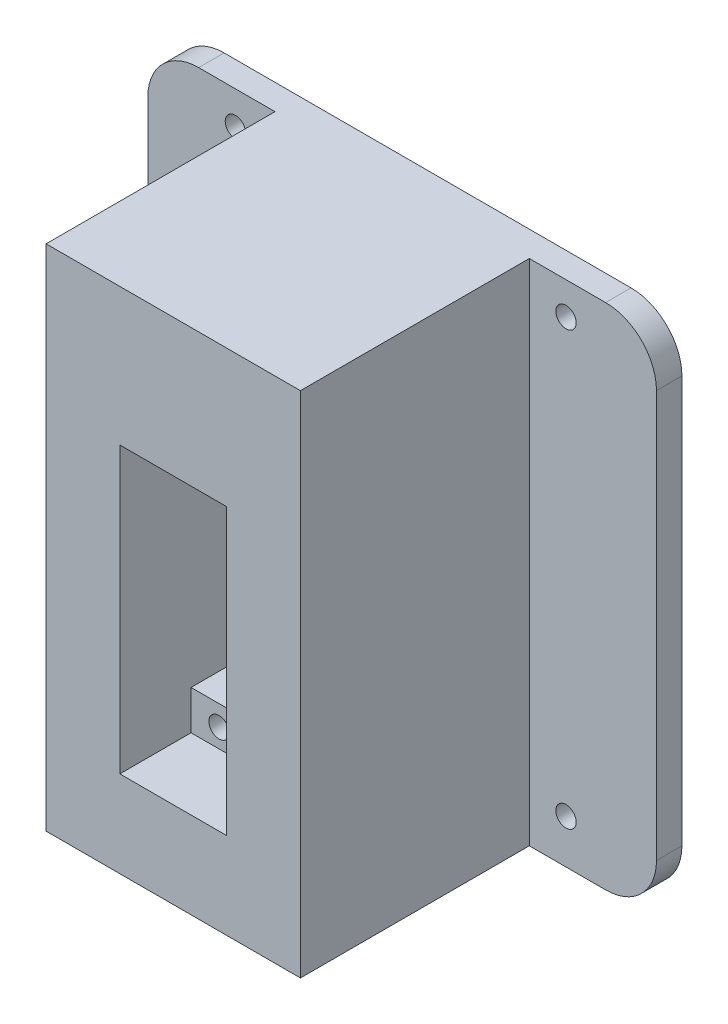
from build123d import *

# Parameters (mm, degrees)
BOSS_EXTRUDE1_DEPTH = 50
SKETCH2_W           = 21
SKETCH2_H           = 56
CUT_EXTRUDE1_DEPTH  = 14
CUT_EXTRUDE2_DEPTH  = 40
CUT_EXTRUDE3_START  = -45
CUT_EXTRUDE3_DEPTH  = 45
SKETCH5_R           = 2
CUT_EXTRUDE4_DEPTH  = 10
SKETCH6_R           = 2
CUT_EXTRUDE5_DEPTH  = 5


with BuildPart() as part:
    # Sketch1 → Boss-Extrude1 (new body)
    with BuildSketch(Plane.XY):
        with BuildLine():
            Line((-40, 50), (40, 50))
            ThreePointArc((40, 50), (47.071067812, 47.071067812), (50, 40))
            Line((50, 40), (50, -40))
            ThreePointArc((50, -40), (47.071067812, -47.071067812), (40, -50))
            Line((40, -50), (-40, -50))
            ThreePointArc((-40, -50), (-47.071067812, -47.071067812), (-50, -40))
            Line((-50, -40), (-50, 40))
            ThreePointArc((-50, 40), (-47.071067812, 47.071067812), (-40, 50))
        make_face()
    extrude(amount=BOSS_EXTRUDE1_DEPTH)

    # Sketch2 → Cut-Extrude1 (cut)
    with BuildSketch(Plane.XY.offset(50)):
        with Locations((0, -5)):
            Rectangle(SKETCH2_W, SKETCH2_H)
    extrude(amount=-CUT_EXTRUDE1_DEPTH, mode=Mode.SUBTRACT)

    # Sketch3 → Cut-Extrude2 (cut)
    with BuildSketch(Plane.XY.offset(36)):
        Polygon((-10.5, 16.220000255), (-10.5, -25.279999745), (10.5, -25.279999745), (10.5, 16.220000255), (2.75, 16.220000255), (2.728552587, 23.719969589), (-2.771447413, 23.719969589), (-2.75, 16.220000255), align=None)
    extrude(amount=-CUT_EXTRUDE2_DEPTH, mode=Mode.SUBTRACT)

    # Sketch4 → Cut-Extrude3 (cut)
    with BuildSketch(Plane.XY.offset(50).offset(CUT_EXTRUDE3_START)):
        with BuildLine():
            Line((40, -50), (25, -50))
            Line((25, -50), (25, 50))
            Line((25, 50), (40, 50))
            ThreePointArc((40, 50), (47.071067812, 47.071067812), (50, 40))
            Line((50, 40), (50, -40))
            ThreePointArc((50, -40), (47.071067812, -47.071067812), (40, -50))
        make_face()
        with BuildLine():
            Line((-40, -50), (-25, -50))
            Line((-25, -50), (-25, 50))
            Line((-25, 50), (-40, 50))
            ThreePointArc((-40, 50), (-47.071067812, 47.071067812), (-50, 40))
            Line((-50, 40), (-50, -40))
            ThreePointArc((-50, -40), (-47.071067812, -47.071067812), (-40, -50))
        make_face()
    extrude(amount=CUT_EXTRUDE3_DEPTH, mode=Mode.SUBTRACT)

    # Sketch5 → Cut-Extrude4 (cut)
    with BuildSketch(Plane.XY.offset(36)):
        with Locations((-5, 19.5)):
            Circle(SKETCH5_R)
        with Locations((5, 19.5)):
            Circle(SKETCH5_R)
        with Locations((-5, -29.3)):
            Circle(SKETCH5_R)
        with Locations((5, -29.3)):
            Circle(SKETCH5_R)
    extrude(amount=-CUT_EXTRUDE4_DEPTH, mode=Mode.SUBTRACT)

    # Sketch6 → Cut-Extrude5 (cut)
    with BuildSketch(Plane.XY.offset(5)):
        with Locations((-32.783708715, 43.482376607)):
            Circle(SKETCH6_R)
        with Locations((-32.783708715, -41.517623393)):
            Circle(SKETCH6_R)
        with Locations((32.216291285, -41.364915091)):
            Circle(SKETCH6_R)
        with Locations((32.216291285, 43.635084909)):
            Circle(SKETCH6_R)
    extrude(amount=-CUT_EXTRUDE5_DEPTH, mode=Mode.SUBTRACT)


solid = part.part
